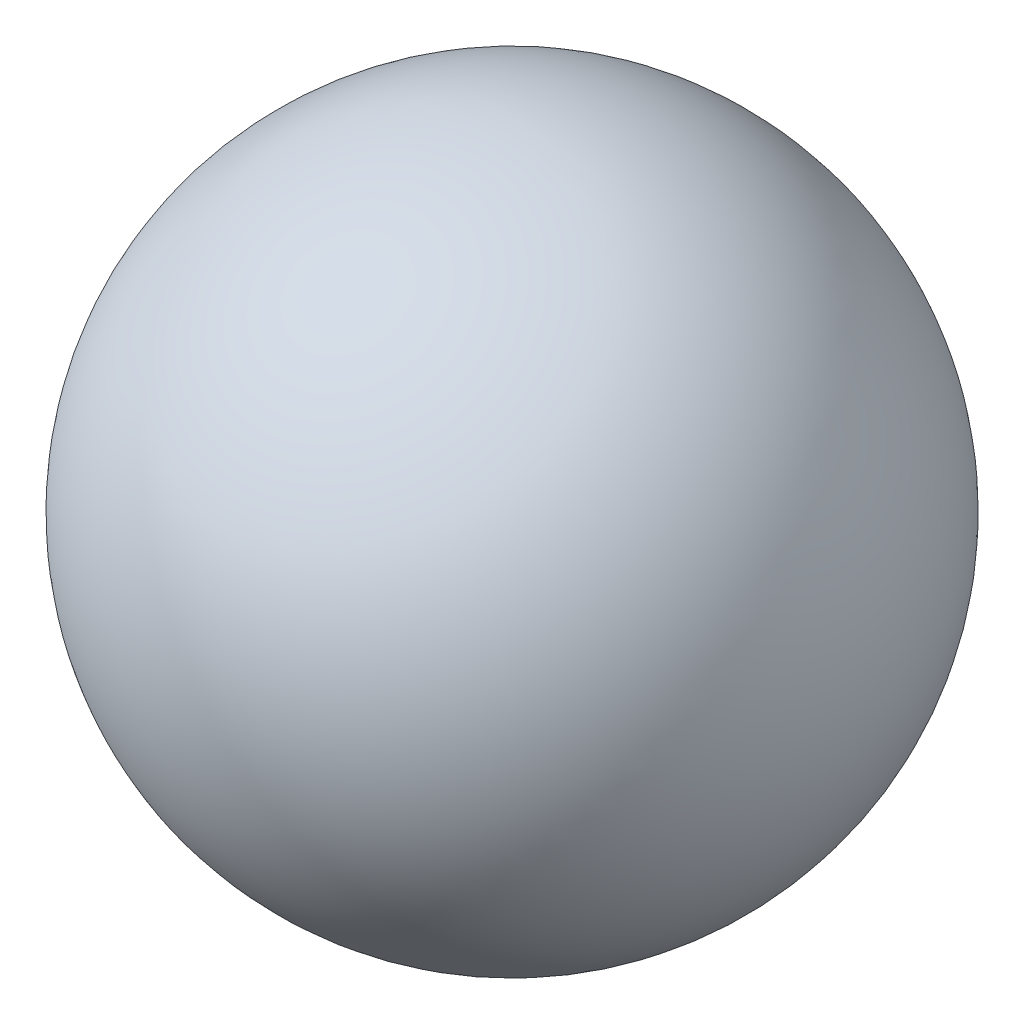
from build123d import *


with BuildPart() as part:
    # Sketch1 → Revolve4 (revolve)
    with BuildSketch(Plane(origin=(0, 0, 0), x_dir=(1, 0, 0), z_dir=(0, 1, 0))):
        with BuildLine():
            Line((0, -12.7), (0, 12.7))
            ThreePointArc((0, 12.7), (-12.7, 0), (0, -12.7))
        make_face()
    revolve(axis=Axis((0, 0, 0), (0, 0, -1)))


solid = part.part
